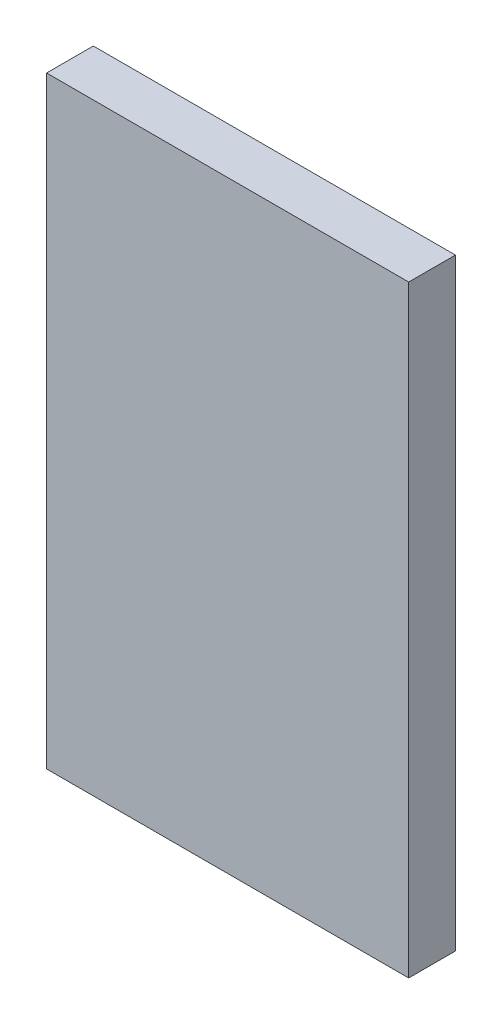
from build123d import *

# Parameters (mm, degrees)
CROQUIS1_W              = 15.5
CROQUIS1_H              = 25.8
SALIENTE_EXTRUIR1_DEPTH = 2


with BuildPart() as part:
    # Croquis1 → Saliente-Extruir1 (new body)
    with BuildSketch(Plane.XY):
        Rectangle(CROQUIS1_W, CROQUIS1_H)
    extrude(amount=SALIENTE_EXTRUIR1_DEPTH)


solid = part.part
